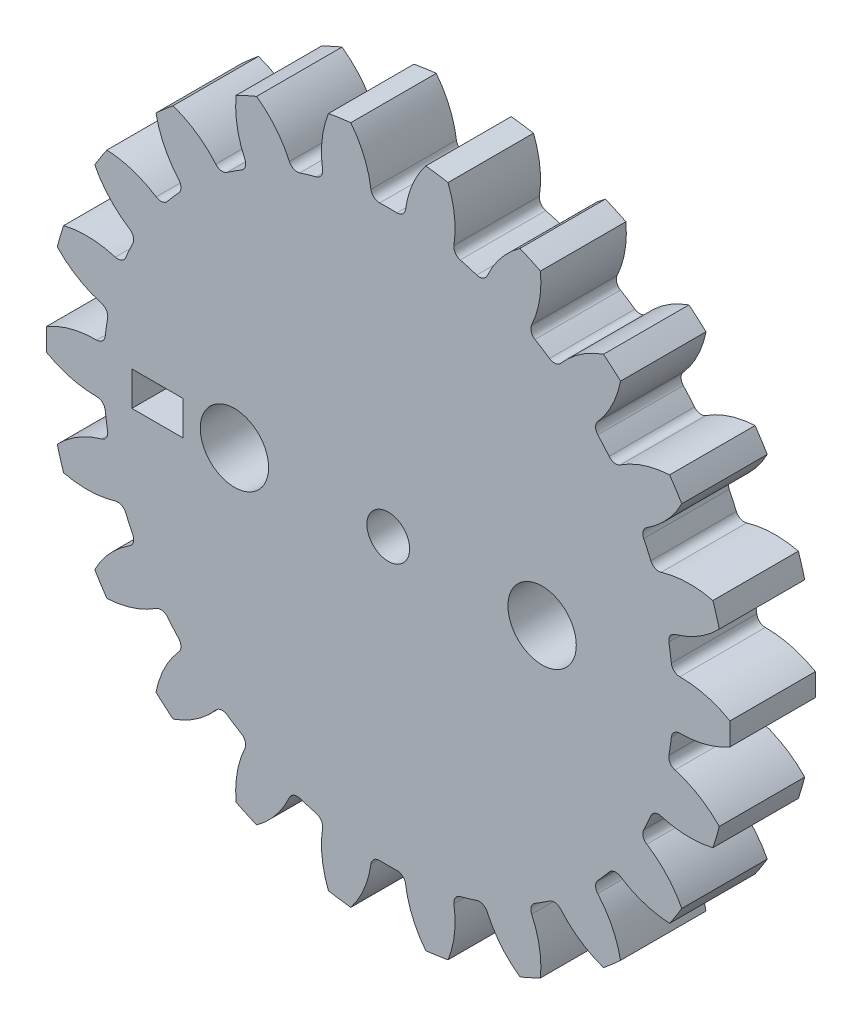
from build123d import *

# Parameters (mm, degrees)
SKETCH1_R                   = 20
BOSS_EXTRUDE1_DEPTH         = 2.5
CUT_EXTRUDE1_DEPTH          = 29.394541729
FILLET2_R                   = 0.5
CIRPATTERN1_COUNT           = 22
FILLET2_OF_CIRPATTERN1_R    = 0.5
STRING_HOLE_DEPTH           = 29.309812613
STRING_HOLE_DEPTH_BACK      = 29.309812613
SKETCH4_R                   = 1.25
TO_KNUCKLE_MOUNT_DEPTH      = 29.309812613
TO_KNUCKLE_MOUNT_DEPTH_BACK = 29.309812613
SKETCH5_R                   = 2
SKETCH6_W                   = 3
SKETCH6_H                   = 2
FOR_ALIGNMENT_DEPTH         = 2


with BuildPart() as part:
    # Sketch1 → Boss-Extrude1 (new, symmetric)
    with BuildSketch(Plane.XY):
        Circle(SKETCH1_R)
    extrude(amount=BOSS_EXTRUDE1_DEPTH, both=True)

    # Sketch3 → Cut-Extrude1 (cut, symmetric)
    with BuildSketch(Plane.XY):
        with BuildLine():
            ThreePointArc((-0.967659311, 16.638552017), (0, 16.666666667), (0.967659311, 16.638552017))
            ThreePointArc((0.967659311, 16.638552017), (1.332322024, 18.352518037), (2.191921142, 19.879524182))
            ThreePointArc((2.191921142, 19.879524182), (0, 20), (-2.191921142, 19.879524182))
            ThreePointArc((-2.191921142, 19.879524182), (-1.332322024, 18.352518037), (-0.967659311, 16.638552017))
        make_face()
    cut_extrude1 = extrude(amount=CUT_EXTRUDE1_DEPTH, both=True, mode=Mode.SUBTRACT)

    # Fillet2
    fillet2_edges = [part.edges().sort_by_distance(p)[0] for p in [
        (0.967659311, 16.638552017, 0),
        (-0.967659311, 16.638552017, 0),
    ]]
    fillet(fillet2_edges, radius=FILLET2_R)

    # CirPattern1: Cut-Extrude1 ×22 about axis
    cirpattern1_axis = Axis((0, 0, 0), (0, 0, 1))
    for i in range(1, CIRPATTERN1_COUNT):
        add(cut_extrude1.rotate(cirpattern1_axis, i * 360 / CIRPATTERN1_COUNT), mode=Mode.SUBTRACT)

    # Fillet2 of CirPattern1
    fillet2_of_cirpattern1_edges = [part.edges().sort_by_distance(p)[0] for p in [
        (-3.759159492, 16.237194884, 0),
        (-5.616084112, 15.69195262, 0),
        (-8.18143355, 14.520396787, 0),
        (-9.809527178, 13.474084545, 0),
        (-11.940896518, 11.627242498, 0),
        (-13.208260692, 10.164626274, 0),
        (-14.732979066, 7.792118172, 0),
        (-15.536939477, 6.031690433, 0),
        (-16.33148327, 3.325722774, 0),
        (-16.606907827, 1.410102905, 0),
        (-16.606907827, -1.410102905, 0),
        (-16.33148327, -3.325722774, 0),
        (-15.536939477, -6.031690433, 0),
        (-14.732979066, -7.792118172, 0),
        (-13.208260692, -10.164626274, 0),
        (-11.940896518, -11.627242498, 0),
        (-9.809527178, -13.474084545, 0),
        (-8.18143355, -14.520396787, 0),
        (-5.616084112, -15.69195262, 0),
        (-3.759159492, -16.237194884, 0),
        (-0.967659311, -16.638552017, 0),
        (0.967659311, -16.638552017, 0),
        (3.759159492, -16.237194884, 0),
        (5.616084112, -15.69195262, 0),
        (8.18143355, -14.520396787, 0),
        (9.809527178, -13.474084545, 0),
        (11.940896518, -11.627242498, 0),
        (13.208260692, -10.164626274, 0),
        (14.732979066, -7.792118172, 0),
        (15.536939477, -6.031690433, 0),
        (16.33148327, -3.325722774, 0),
        (16.606907827, -1.410102905, 0),
        (16.606907827, 1.410102905, 0),
        (16.33148327, 3.325722774, 0),
        (15.536939477, 6.031690433, 0),
        (14.732979066, 7.792118172, 0),
        (13.208260692, 10.164626274, 0),
        (11.940896518, 11.627242498, 0),
        (9.809527178, 13.474084545, 0),
        (8.18143355, 14.520396787, 0),
        (5.616084112, 15.69195262, 0),
        (3.759159492, 16.237194884, 0),
    ]]
    fillet(fillet2_of_cirpattern1_edges, radius=FILLET2_OF_CIRPATTERN1_R)

    # Sketch4 → String_Hole (cut, two sides: drawn at the far end of the back side and taken through both)
    with BuildSketch(Plane.XY.offset(-STRING_HOLE_DEPTH_BACK)):
        Circle(SKETCH4_R)
    extrude(amount=STRING_HOLE_DEPTH + STRING_HOLE_DEPTH_BACK, mode=Mode.SUBTRACT)

    # Sketch5 → To_Knuckle_Mount (cut, two sides: drawn at the far end of the back side and taken through both)
    with BuildSketch(Plane.XY.offset(-TO_KNUCKLE_MOUNT_DEPTH_BACK)):
        with Locations((9, 0)):
            Circle(SKETCH5_R)
        with Locations((-9, 0)):
            Circle(SKETCH5_R)
    extrude(amount=TO_KNUCKLE_MOUNT_DEPTH + TO_KNUCKLE_MOUNT_DEPTH_BACK, mode=Mode.SUBTRACT)

    # Sketch6 → For_Alignment (cut)
    with BuildSketch(Plane.XY.offset(2.5)):
        with Locations((-13.5, 0)):
            Rectangle(SKETCH6_W, SKETCH6_H)
    extrude(amount=-FOR_ALIGNMENT_DEPTH, mode=Mode.SUBTRACT)


solid = part.part
